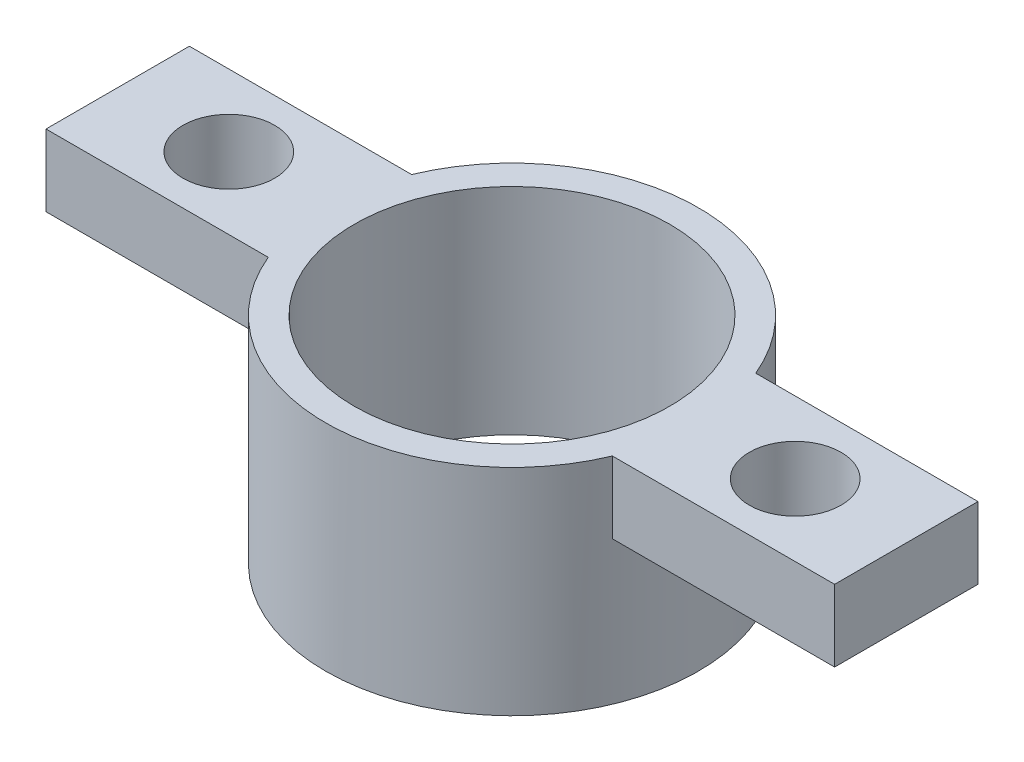
from build123d import *

# Parameters (mm, degrees)
SKETCH1_R                = 6.5
SKETCH1_R_2              = 5.5
BOSS_EXTRUDE1_DEPTH      = 7.5
BOSS_EXTRUDE2_START      = -2.5
BOSS_EXTRUDE2_DEPTH      = 2.5
M3_CLEARANCE_HOLE1_D     = 3.2
M3_CLEARANCE_HOLE1_DEPTH = 5
M3_CLEARANCE_HOLE1_TIP   = 0.96137699


with BuildPart() as part:
    # Sketch1 → Boss-Extrude1 (new body)
    with BuildSketch(Plane(origin=(0, 0, 0), x_dir=(1, 0, 0), z_dir=(0, 1, 0))):
        with Locations(Location((0, 0, 0), (0, 0, 270))):
            Circle(SKETCH1_R)
        with Locations(Location((0, 0, 0), (0, 0, 270))):
            Circle(SKETCH1_R_2, mode=Mode.SUBTRACT)
    extrude(amount=BOSS_EXTRUDE1_DEPTH)

    # Sketch2 → Boss-Extrude2 (add)
    with BuildSketch(Plane(origin=(0, 7.5, 0), x_dir=(1, 0, 0), z_dir=(0, 1, 0)).offset(BOSS_EXTRUDE2_START)):
        with BuildLine():
            Line((-13.75, 2.5), (-6, 2.5))
            ThreePointArc((-6, 2.5), (-6.5, 0), (-6, -2.5))
            Line((-6, -2.5), (-13.75, -2.5))
            Line((-13.75, -2.5), (-13.75, 2.5))
        make_face()
        with BuildLine():
            Line((13.75, -2.5), (13.75, 2.5))
            Line((13.75, 2.5), (6, 2.5))
            ThreePointArc((6, 2.5), (6.5, 0), (6, -2.5))
            Line((6, -2.5), (13.75, -2.5))
        make_face()
    extrude(amount=BOSS_EXTRUDE2_DEPTH)

    # M3 Clearance Hole1
    with Locations(Plane(origin=(9.875, 5, 0), x_dir=(0, 0, -1), z_dir=(0, -1, 0))):
        with Locations((0, 0), (0, -19.75)):
            Hole(M3_CLEARANCE_HOLE1_D / 2, depth=M3_CLEARANCE_HOLE1_DEPTH)
            with Locations((0, 0, -(M3_CLEARANCE_HOLE1_DEPTH + M3_CLEARANCE_HOLE1_TIP / 2))):  # 118° drill point
                Cone(0, M3_CLEARANCE_HOLE1_D / 2, M3_CLEARANCE_HOLE1_TIP, mode=Mode.SUBTRACT)


solid = part.part
